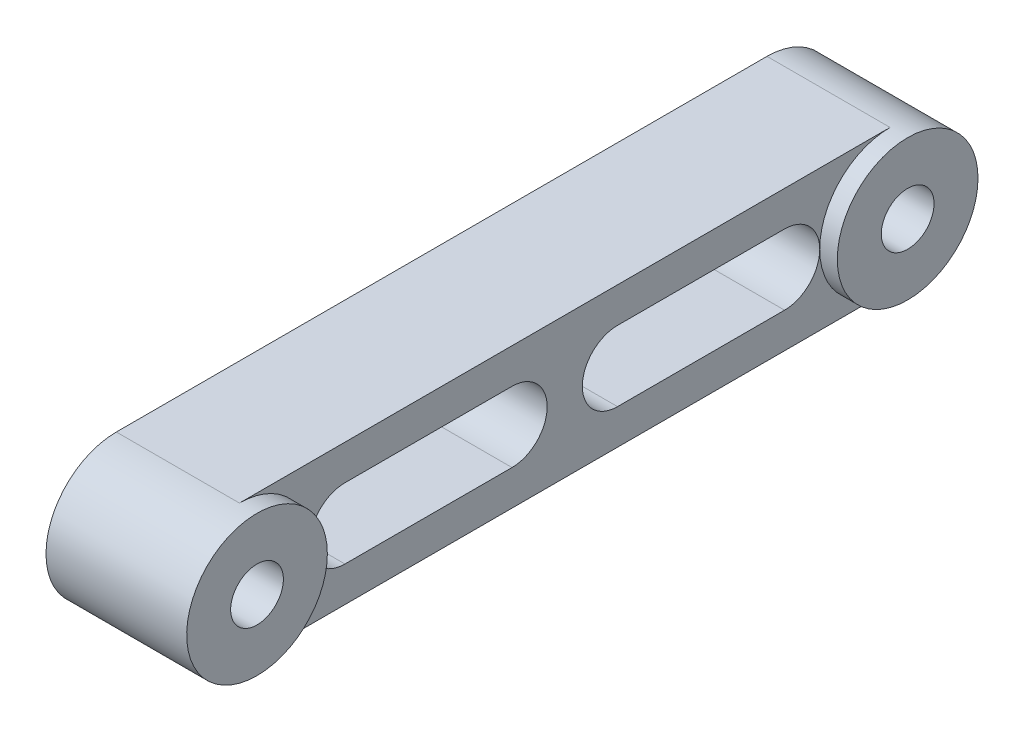
from build123d import *

# Parameters (mm, degrees)
SKETCH_2_R          = 1.5
EXTRUDE_1_DEPTH     = 7
CUT_EXTRUDE_1_DEPTH = 5
SKETCH_4_R          = 1.5
EXTRUDE_2_DEPTH     = 1


with BuildPart() as part:
    # 草图2 → 凸台-拉伸1 (new body)
    with BuildSketch(Plane(origin=(0, 0, 0), x_dir=(0, 0, -1), z_dir=(1, 0, 0))):
        with BuildLine():
            Line((0, 4), (37, 4))
            ThreePointArc((37, 4), (41, 0), (37, -4))
            Line((37, -4), (0, -4))
            ThreePointArc((0, -4), (-4, 0), (0, 4))
        make_face()
        Circle(SKETCH_2_R, mode=Mode.SUBTRACT)
        with Locations((37, 0)):
            Circle(SKETCH_2_R, mode=Mode.SUBTRACT)
    extrude(amount=EXTRUDE_1_DEPTH)

    # 草图3 → 切除-拉伸1 (cut)
    with BuildSketch(Plane(origin=(7, 0, 0), x_dir=(0, 0, -1), z_dir=(1, 0, 0))):
        with BuildLine():
            Line((15.5, -2), (6, -2))
            ThreePointArc((6, -2), (4, 0), (6, 2))
            Line((6, 2), (15.5, 2))
            ThreePointArc((15.5, 2), (17.5, 0), (15.5, -2))
        make_face()
        with BuildLine():
            Line((21.5, -2), (31, -2))
            ThreePointArc((31, -2), (33, 0), (31, 2))
            Line((31, 2), (21.5, 2))
            ThreePointArc((21.5, 2), (19.5, 0), (21.5, -2))
        make_face()
    extrude(amount=-CUT_EXTRUDE_1_DEPTH, mode=Mode.SUBTRACT)

    # 草图4 → 凸台-拉伸2 (add)
    # profile 1 of 2: a face of its own
    with BuildSketch(Plane(origin=(7, 0, 0), x_dir=(0, 0, -1), z_dir=(1, 0, 0))):
        with BuildLine():
            ThreePointArc((37, -4), (39.828427125, -2.828427125), (41, 0))
            ThreePointArc((41, 0), (39.828427125, 2.828427125), (37, 4))
            ThreePointArc((37, 4), (33, 0), (37, -4))
        make_face()
        with Locations((37, 0)):
            Circle(SKETCH_4_R, mode=Mode.SUBTRACT)
    # profile 2 of 2: a face of its own
    with BuildSketch(Plane(origin=(7, 0, 0), x_dir=(0, 0, -1), z_dir=(1, 0, 0))):
        with BuildLine():
            ThreePointArc((0, -4), (2.828427125, -2.828427125), (4, 0))
            ThreePointArc((4, 0), (2.828427125, 2.828427125), (0, 4))
            ThreePointArc((0, 4), (-4, 0), (0, -4))
        make_face()
        Circle(SKETCH_4_R, mode=Mode.SUBTRACT)
    extrude(amount=EXTRUDE_2_DEPTH)


solid = part.part
